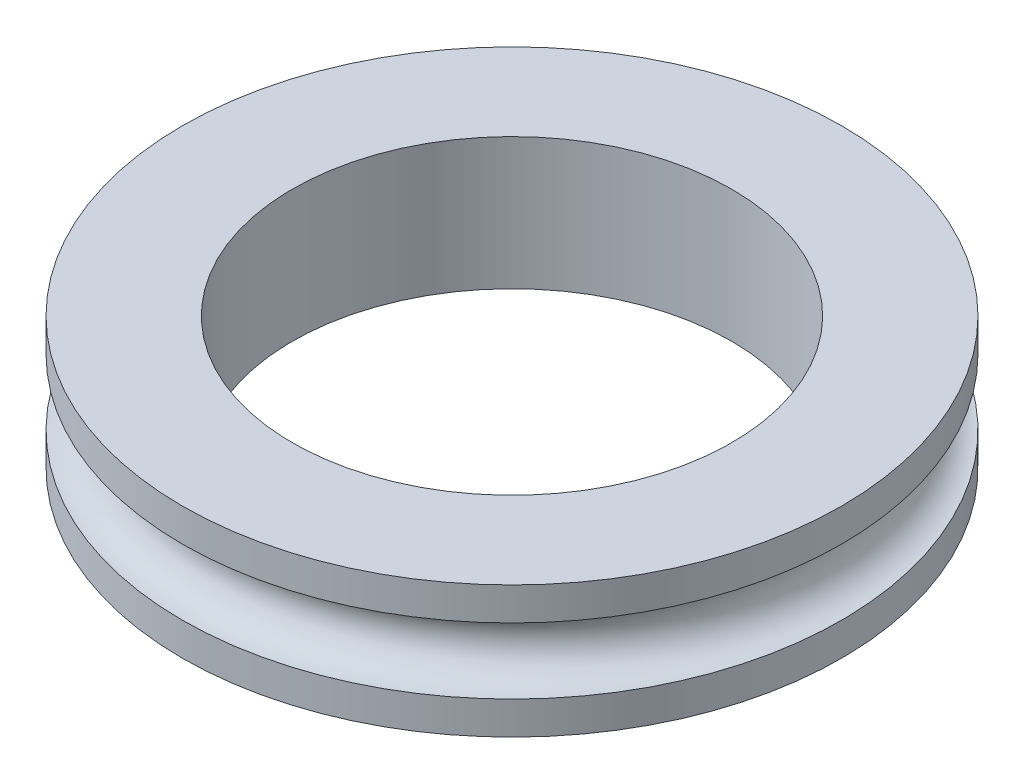
from build123d import *

# Parameters (mm, degrees)
CROQUIS1_R              = 7.5
SALIENTE_EXTRUIR1_DEPTH = 3
CROQUIS2_R              = 0.75
CROQUIS4_R              = 5
CORTAR_EXTRUIR1_DEPTH   = 12.022703843


with BuildPart() as part:
    # Croquis1 → Saliente-Extruir1 (new body)
    with BuildSketch(Plane(origin=(0, 0, 0), x_dir=(1, 0, 0), z_dir=(0, 1, 0))):
        with Locations(Location((0, 0, 0), (0, 0, 270))):
            Circle(CROQUIS1_R)
    extrude(amount=SALIENTE_EXTRUIR1_DEPTH)

    # Croquis2 → Cortar-Revolución1 (revolve, cut)
    with BuildSketch(Plane(origin=(0, 0, 0), x_dir=(0, 0, -1), z_dir=(1, 0, 0)), mode=Mode.PRIVATE) as cortar_revoluci_n1_sk:
        with Locations((7.5, 1.5)):
            Circle(CROQUIS2_R)
    revolve(cortar_revoluci_n1_sk.sketch.rotate(Axis((0, 3, 0), (0, -1, 0)), 180), axis=Axis((0, 3, 0), (0, -1, 0)), mode=Mode.SUBTRACT)

    # Croquis4 → Cortar-Extruir1 (cut, through all)
    with BuildSketch(Plane.XZ):
        with Locations(Location((0, 0, 0), (0, 0, 270))):
            Circle(CROQUIS4_R)
    extrude(amount=-CORTAR_EXTRUIR1_DEPTH, mode=Mode.SUBTRACT)


solid = part.part
